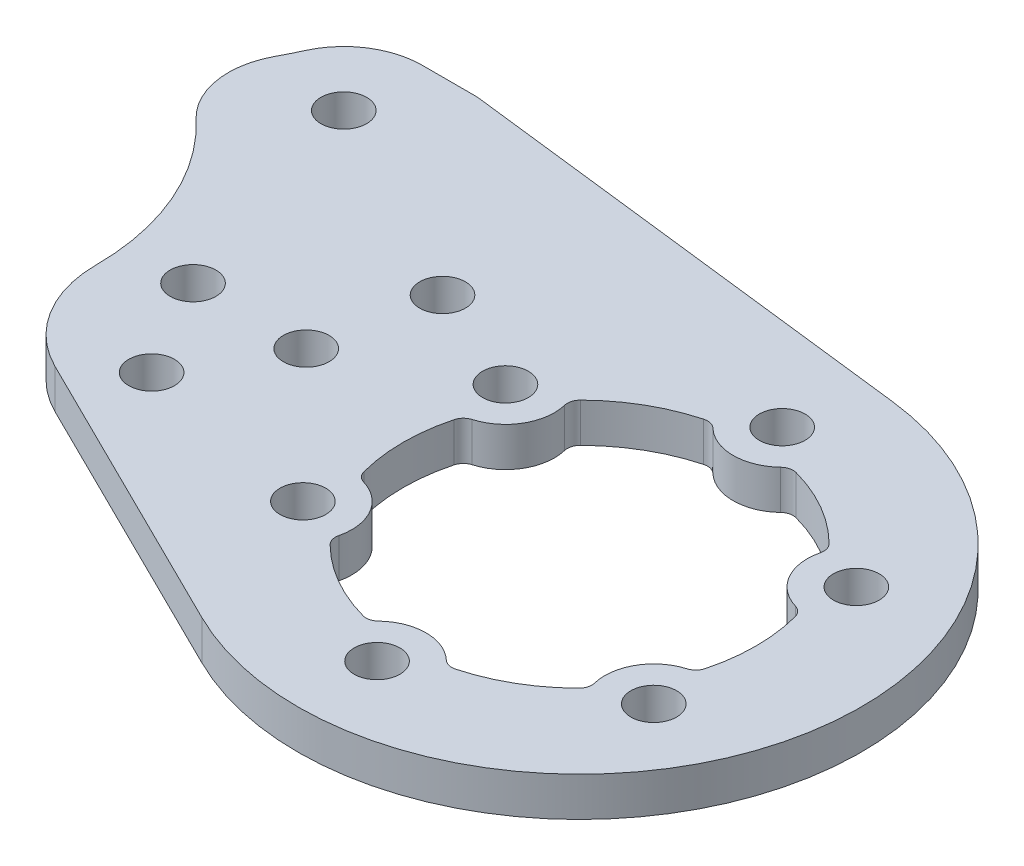
from build123d import *

# Parameters (mm, degrees)
SKETCH_2_R                       = 1.75
EXTRUDE_1_DEPTH                  = 3
CUT_EXTRUDE_1_REACH              = 62.067
SKETCH_3_R                       = 13.5
EXTRUDE_START                    = -3
SKETCH_4_R                       = 3.75
SKETCH_4_R_2                     = 1.75
EXTRUDE_2_DEPTH                  = 3
FILLET_1_R                       = 1
PATTERN_CIRCULAR_1_COUNT         = 6
FILLET_1_OF_PATTERN_CIRCULAR_1_R = 1


with BuildPart() as part:
    # 草图2 → 凸台-拉伸1 (new body)
    with BuildSketch(Plane(origin=(0, 0, 0), x_dir=(1, 0, 0), z_dir=(0, 1, 0))):
        with BuildLine():
            ThreePointArc((-3.33566455, 16.339576043), (-3.689884424, 16.371156277), (-4.04535307, 16.381695363))
            Line((-4.04535307, 16.381695363), (-7.902002826, 16.381695363))
            ThreePointArc((-7.902002826, 16.381695363), (-11.154056436, 15.423931704), (-13.367877124, 12.856411137))
            ThreePointArc((-13.367877124, 12.856411137), (-13.731255095, 12.088797564), (-14.12049634, 11.333969504))
            ThreePointArc((-14.12049634, 11.333969504), (-14.757788596, 7.532855597), (-12.951275808, 4.128282218))
            ThreePointArc((-12.951275808, 4.128282218), (-8.656551428, -2.002025351), (-7.142353364, -9.332273137))
            ThreePointArc((-7.142353364, -9.332273137), (-5.751591288, -14.210272651), (-1.997514606, -17.62143179))
            Line((-1.997514606, -17.62143179), (20.286858748, -28.657647844))
            ThreePointArc((20.286858748, -28.657647844), (50.527581311, -15.482386054), (32.408442676, 12.08182334))
            Line((32.408442676, 12.08182334), (-3.33566455, 16.339576043))
        make_face()
        with Locations((2.107646636, -14.332273137)):
            Circle(SKETCH_2_R, mode=Mode.SUBTRACT)
        with Locations((-2.222480383, -6.832273137)):
            Circle(SKETCH_2_R, mode=Mode.SUBTRACT)
        with Locations((6.437773655, -6.832273137)):
            Circle(SKETCH_2_R, mode=Mode.SUBTRACT)
        with Locations((8.10172473, 1.934042232)):
            Circle(SKETCH_2_R, mode=Mode.SUBTRACT)
        with Locations((-7.902002826, 10.381695363)):
            Circle(SKETCH_2_R, mode=Mode.SUBTRACT)
        with Locations((29.857646636, -24.832273137)):
            Circle(SKETCH_2_R, mode=Mode.SUBTRACT)
        with Locations((43.281040395, -17.082273137)):
            Circle(SKETCH_2_R, mode=Mode.SUBTRACT)
        with Locations((16.434252877, -1.582273137)):
            Circle(SKETCH_2_R, mode=Mode.SUBTRACT)
        with Locations((43.281040395, -1.582273137)):
            Circle(SKETCH_2_R, mode=Mode.SUBTRACT)
        with Locations((29.857646636, 6.167726863)):
            Circle(SKETCH_2_R, mode=Mode.SUBTRACT)
        with Locations((16.434252877, -17.082273137)):
            Circle(SKETCH_2_R, mode=Mode.SUBTRACT)
    extrude(amount=EXTRUDE_1_DEPTH)

    # 草图3 → 切除-拉伸1 (cut, up to next)
    with BuildSketch(Plane(origin=(0, 3, 0), x_dir=(1, 0, 0), z_dir=(0, 1, 0)), mode=Mode.PRIVATE) as cut_extrude_1_sk1:
        with Locations((29.857646636, -9.332273137)):
            Circle(SKETCH_3_R)
    cut_extrude_1_tool1 = extrude(cut_extrude_1_sk1.sketch, amount=-CUT_EXTRUDE_1_REACH, mode=Mode.PRIVATE) & part.part
    add(cut_extrude_1_tool1.solids().sort_by_distance((29.857647, 3, 9.332273))[0], mode=Mode.SUBTRACT)

    # 草图4 → 凸台-拉伸2 (add)
    with BuildSketch(Plane(origin=(0, 3, 0), x_dir=(1, 0, 0), z_dir=(0, 1, 0)).offset(EXTRUDE_START)):
        with Locations((29.857646636, 6.167726863)):
            Circle(SKETCH_4_R)
        with Locations((29.857646636, 6.167726863)):
            Circle(SKETCH_4_R_2, mode=Mode.SUBTRACT)
    extrude_2 = extrude(amount=EXTRUDE_2_DEPTH)

    # 圆角1
    fillet_1_edges = [part.edges().sort_by_distance(p)[0] for p in [
        (32.800222011, 1.5, -3.843130088),
        (26.915071261, 1.5, -3.843130088),
    ]]
    fillet(fillet_1_edges, radius=FILLET_1_R)

    # 阵列(圆周)1: 凸台-拉伸2 ×6 about axis
    pattern_circular_1_axis = Axis((29.857646636, 3, 9.332273137), (0, -1, 0))
    for i in range(1, PATTERN_CIRCULAR_1_COUNT):
        add(extrude_2.rotate(pattern_circular_1_axis, i * 360 / PATTERN_CIRCULAR_1_COUNT))

    # 圆角1 of 阵列(圆周)1
    fillet_1_of_pattern_circular_1_edges = [part.edges().sort_by_distance(p)[0] for p in [
        (42.739168222, 1.5, 5.292916552),
        (39.796592847, 1.5, 0.196226497),
        (39.796592847, 1.5, 18.468319778),
        (42.739168222, 1.5, 13.371629723),
        (26.915071261, 1.5, 22.507676363),
        (32.800222011, 1.5, 22.507676363),
        (16.97612505, 1.5, 13.371629723),
        (19.918700425, 1.5, 18.468319778),
        (19.918700425, 1.5, 0.196226497),
        (16.97612505, 1.5, 5.292916552),
    ]]
    fillet(fillet_1_of_pattern_circular_1_edges, radius=FILLET_1_OF_PATTERN_CIRCULAR_1_R)


solid = part.part
